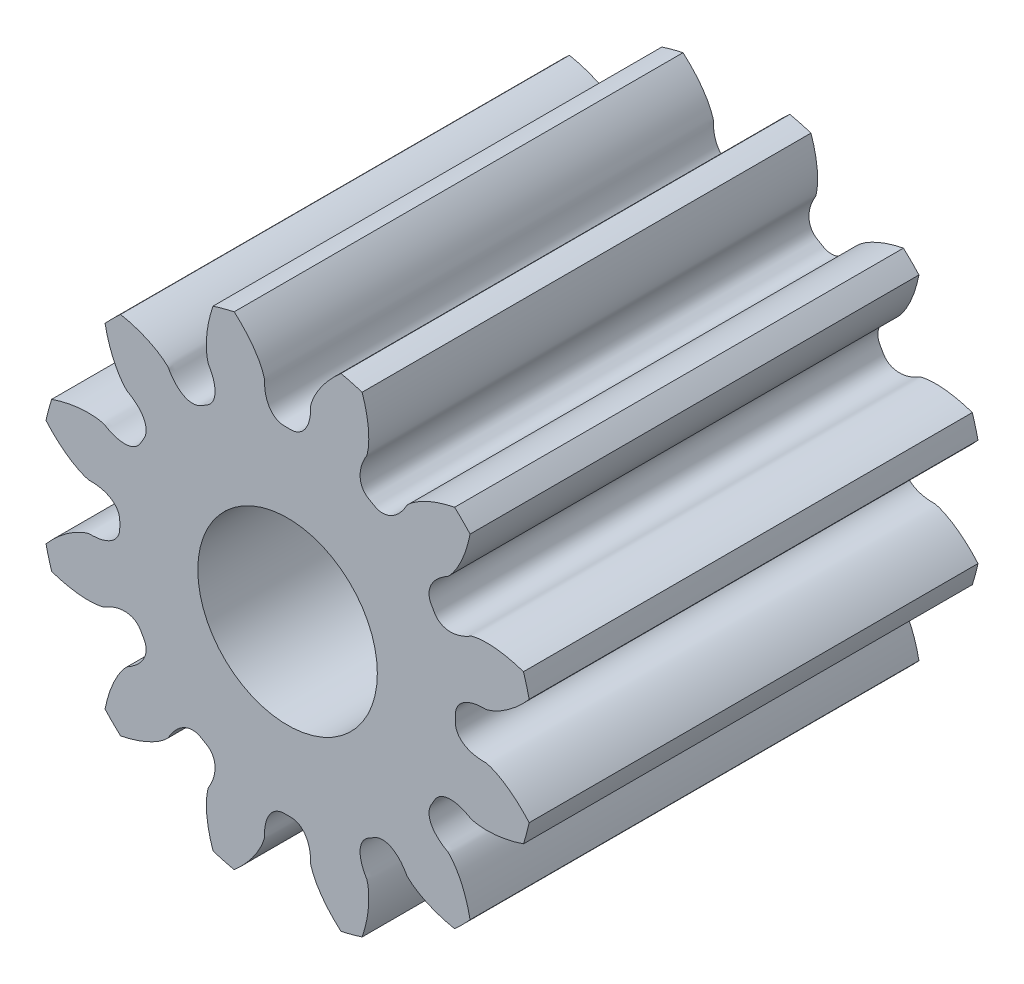
from build123d import *

# Parameters (mm, degrees)
SKETCHREVOLVESPUR01_W       = 12.7
SKETCHREVOLVESPUR01_H       = 7
TOOTHEXTRUDECUTSPUR01_DEPTH = 9.525
PATTERNSPUR01_COUNT         = 12


with BuildPart() as part:
    # SketchRevolveSpur01 → Spur01 (revolve)
    with BuildSketch(Plane(origin=(0, 0, 0), x_dir=(0, 0, -1), z_dir=(1, 0, 0))):
        with Locations((0, 3.5)):
            Rectangle(SKETCHREVOLVESPUR01_W, SKETCHREVOLVESPUR01_H)
    revolve(axis=Axis((0, 0, 0), (0, 0, -1)))

    # SketchToothSpur01 → ToothExtrudeCutSpur01 (cut, symmetric)
    with BuildSketch(Plane.XY):
        with BuildLine():
            ThreePointArc((6.875836275, 1.557361719), (7.05, 0), (6.875836275, -1.557361719))
            add(Edge.make_bspline(
                [(6.875836275, -1.557361719), (6.841998979, -1.518361597), (6.776059633, -1.442361357), (6.674588915, -1.336014507), (6.575162583, -1.238848073), (6.477983934, -1.150871633), (6.383676683, -1.071693224), (6.292735503, -1.000985553), (6.205659347, -0.938372874), (6.122917364, -0.883460208), (6.044955748, -0.835827361), (5.972194642, -0.795033325), (5.905027831, -0.760612432), (5.843820827, -0.732091208), (5.78891265, -0.708941327), (5.740606801, -0.690730602), (5.69919509, -0.676675658), (5.658608566, -0.665161801), (5.60717949, -0.649975993), (5.547867027, -0.65737871), (5.488129386, -0.653560932), (5.43698555, -0.650235792), (5.387279443, -0.644789107), (5.338959112, -0.637790533), (5.292030782, -0.629097845), (5.24647996, -0.618738624), (5.202292482, -0.606678925), (5.159450394, -0.592878974), (5.117935402, -0.577273721), (5.077731956, -0.559772097), (5.03883279, -0.540250759), (5.001247253, -0.518549133), (4.965013664, -0.494465061), (4.930216892, -0.467753288), (4.897012035, -0.438129756), (4.865654353, -0.405286346), (4.83653146, -0.368922357), (4.810195063, -0.328798465), (4.787359732, -0.284817766), (4.768921402, -0.237119235), (4.755694648, -0.186189291), (4.749657152, -0.138315613), (4.747187265, -0.076041662), (4.750637578, 0), (4.747187265, 0.076041662), (4.749657152, 0.138315613), (4.755694648, 0.186189291), (4.768921402, 0.237119235), (4.787359732, 0.284817766), (4.810195063, 0.328798465), (4.83653146, 0.368922357), (4.865654353, 0.405286346), (4.897012035, 0.438129756), (4.930216892, 0.467753288), (4.965013664, 0.494465061), (5.001247253, 0.518549133), (5.03883279, 0.540250759), (5.077731956, 0.559772097), (5.117935402, 0.577273721), (5.159450394, 0.592878974), (5.202292482, 0.606678925), (5.24647996, 0.618738624), (5.292030782, 0.629097845), (5.338959112, 0.637790533), (5.387279443, 0.644789107), (5.43698555, 0.650235792), (5.488129386, 0.653560932), (5.547867027, 0.65737871), (5.60717949, 0.649975993), (5.658608566, 0.665161801), (5.69919509, 0.676675658), (5.740606801, 0.690730602), (5.78891265, 0.708941327), (5.843820827, 0.732091208), (5.905027831, 0.760612432), (5.972194642, 0.795033325), (6.044955748, 0.835827361), (6.122917364, 0.883460208), (6.205659347, 0.938372874), (6.292735503, 1.000985553), (6.383676683, 1.071693224), (6.477983934, 1.150871633), (6.575162583, 1.238848073), (6.674588915, 1.336014507), (6.776059633, 1.442361357), (6.841998979, 1.518361597), (6.875836275, 1.557361719)],
                knots=[0, 0, 0, 0, 0.027444097, 0.053480804, 0.078110122, 0.10133205, 0.123146589, 0.143553738, 0.162553498, 0.180145868, 0.196330848, 0.211108439, 0.224478641, 0.236441453, 0.246996876, 0.256144909, 0.263885553, 0.270218807, 0.278620863, 0.292086343, 0.301392331, 0.310467363, 0.319321627, 0.327966792, 0.33641626, 0.344685454, 0.35279216, 0.360756909, 0.3686034, 0.376358952, 0.384054943, 0.391727179, 0.399416081, 0.407166503, 0.415026923, 0.423047626, 0.431277452, 0.439758752, 0.448520508, 0.457570399, 0.466887684, 0.476419849, 0.483158084, 0.5, 0.516841916, 0.523580151, 0.533112316, 0.542429601, 0.551479492, 0.560241248, 0.568722548, 0.576952374, 0.584973077, 0.592833497, 0.600583919, 0.608272821, 0.615945057, 0.623641048, 0.6313966, 0.639243091, 0.64720784, 0.655314546, 0.66358374, 0.672033208, 0.680678373, 0.689532637, 0.698607669, 0.707913657, 0.721379137, 0.729781193, 0.736114447, 0.743855091, 0.753003124, 0.763558547, 0.775521359, 0.788891561, 0.803669152, 0.819854132, 0.837446502, 0.856446262, 0.876853411, 0.89866795, 0.921889878, 0.946519196, 0.972555903, 1, 1, 1, 1], degree=3))
        make_face()
    toothextrudecutspur01 = extrude(amount=TOOTHEXTRUDECUTSPUR01_DEPTH, both=True, mode=Mode.SUBTRACT)

    # PatternSpur01: ToothExtrudeCutSpur01 ×12 about axis
    patternspur01_axis = Axis((0, 0, 55), (0, 0, -1))
    for i in range(1, PATTERNSPUR01_COUNT):
        add(toothextrudecutspur01.rotate(patternspur01_axis, i * 360 / PATTERNSPUR01_COUNT), mode=Mode.SUBTRACT)

    # BoreRevolveSketch → BoreRevolveCut (revolve, cut)
    with BuildSketch(Plane(origin=(0, 0, 0), x_dir=(0, 0, -1), z_dir=(1, 0, 0))):
        Polygon((-9.525, 0), (9.525, 0), (9.525, 2.794), (9.271, 2.54), (-9.271, 2.54), (-9.525, 2.794), align=None)
    revolve(axis=Axis((0, 0, 0), (0, 0, -1)), mode=Mode.SUBTRACT)


solid = part.part
